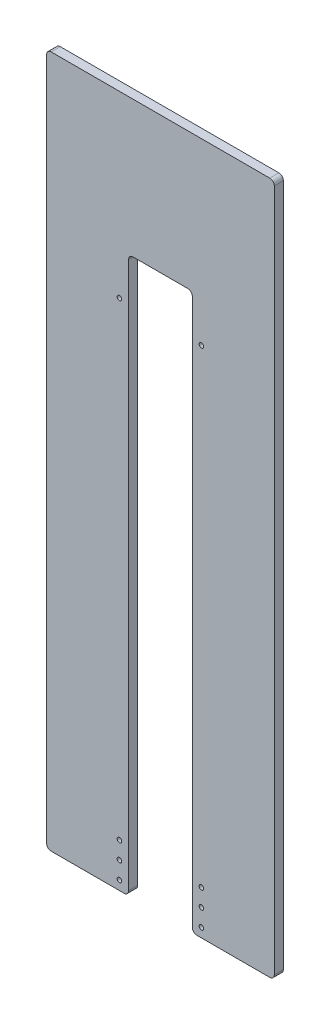
from build123d import *

# Parameters (mm, degrees)
BOSS_EXTRUDE1_DEPTH = 10
M6_TAPPED_HOLE_D    = 5


with BuildPart() as part:
    # Sketch1 → Boss-Extrude1 (new body)
    with BuildSketch(Plane.XY):
        with BuildLine():
            Line((-120, -760), (-200, -760))
            ThreePointArc((-200, -760), (-203.535533906, -758.535533906), (-205, -755))
            Line((-205, -755), (-205, -5))
            ThreePointArc((-205, -5), (-203.535533906, -1.464466094), (-200, 0))
            Line((-200, 0), (40, 0))
            ThreePointArc((40, 0), (43.535533906, -1.464466094), (45, -5))
            Line((45, -5), (45, -755))
            ThreePointArc((45, -755), (43.535533906, -758.535533906), (40, -760))
            Line((40, -760), (-40, -760))
            ThreePointArc((-40, -760), (-43.535533906, -758.535533906), (-45, -755))
            Line((-45, -755), (-45, -155))
            ThreePointArc((-45, -155), (-46.464466094, -151.464466094), (-50, -150))
            Line((-50, -150), (-110, -150))
            ThreePointArc((-110, -150), (-113.535533906, -151.464466094), (-115, -155))
            Line((-115, -155), (-115, -755))
            ThreePointArc((-115, -755), (-116.464466094, -758.535533906), (-120, -760))
        make_face()
    extrude(amount=BOSS_EXTRUDE1_DEPTH)

    # M6 Tapped Hole (through all)
    with Locations(Plane(origin=(479.845790405, 700.886073068, 20), x_dir=(-1, 0, 0), z_dir=(0, 0, 1))):
        with Locations((514.845790405, 897.471608895), (537.845790405, 897.471608895), (581.845790405, 897.471608895), (604.845790405, 897.471608895), (514.845790405, 1450.886073068), (514.845790405, 1412.886073068), (537.845790405, 1453.886073068), (537.845790405, 1409.886073068), (581.845790405, 1453.886073068), (581.845790405, 1409.886073068), (604.845790405, 1450.886073068), (604.845790405, 1412.886073068), (514.845790405, 1431.886073068), (537.845790405, 1431.886073068), (581.845790405, 1431.886073068), (604.845790405, 1431.886073068)):
            Hole(M6_TAPPED_HOLE_D / 2)


solid = part.part
